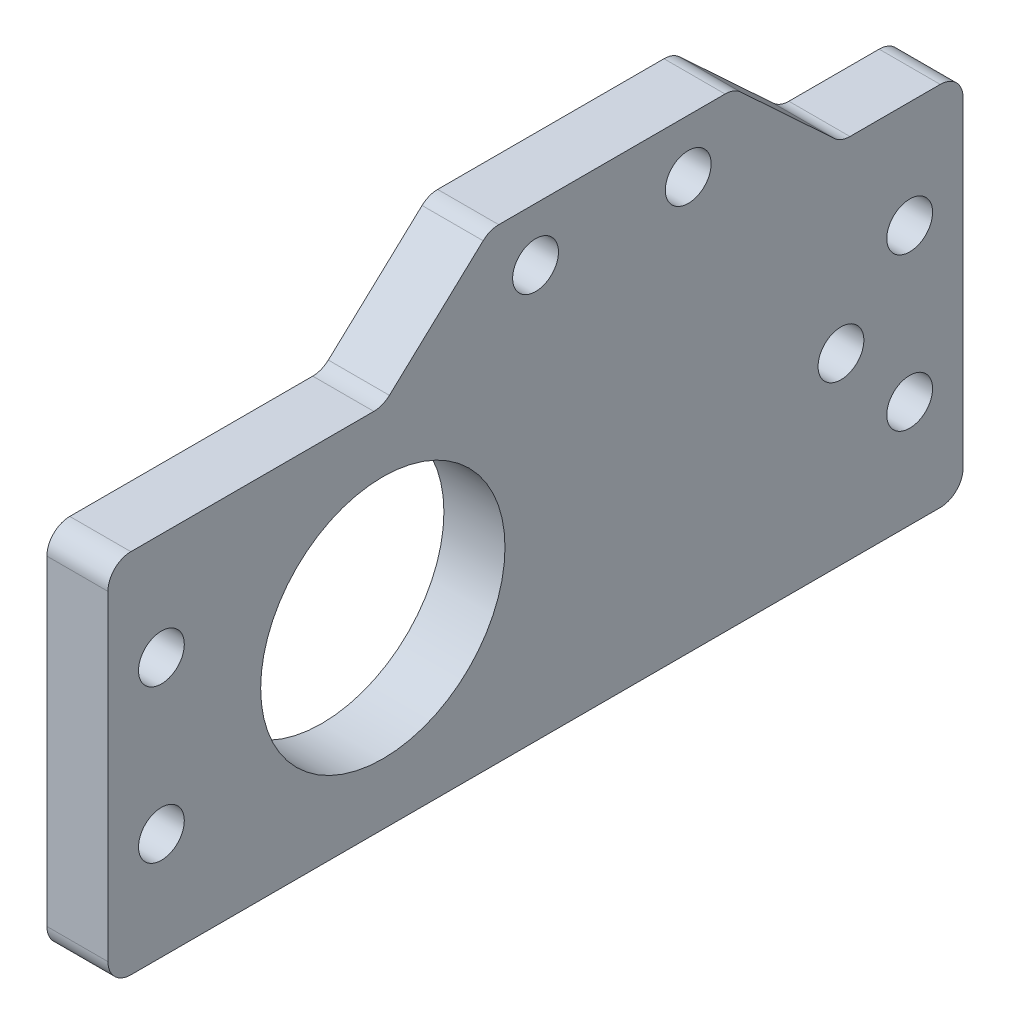
from build123d import *

# Parameters (mm, degrees)
SKETCH_1_R      = 1.5
SKETCH_1_R_2    = 8
EXTRUDE_1_DEPTH = 4


with BuildPart() as part:
    # 草图1 → 凸台-拉伸1 (new body)
    with BuildSketch(Plane(origin=(0, 0, 0), x_dir=(0, 0, -1), z_dir=(1, 0, 0))):
        with BuildLine():
            Line((20.589035366, 12), (26.5, 12))
            ThreePointArc((26.5, 12), (27.560660172, 11.560660172), (28, 10.5))
            Line((28, 10.5), (28, -10.5))
            ThreePointArc((28, -10.5), (27.560660172, -11.560660172), (26.5, -12))
            Line((26.5, -12), (-26.5, -12))
            ThreePointArc((-26.5, -12), (-27.560660172, -11.560660172), (-28, -10.5))
            Line((-28, -10.5), (-28, 10.5))
            ThreePointArc((-28, 10.5), (-27.560660172, 11.560660172), (-26.5, 12))
            Line((-26.5, 12), (-10.589035366, 12))
            ThreePointArc((-10.589035366, 12), (-10.040758683, 12.103793469), (-9.568358717, 12.400809763))
            Line((-9.568358717, 12.400809763), (-3.431641283, 18.099190237))
            ThreePointArc((-3.431641283, 18.099190237), (-2.959241317, 18.396206531), (-2.410964634, 18.5))
            Line((-2.410964634, 18.5), (12.410964634, 18.5))
            ThreePointArc((12.410964634, 18.5), (12.959241317, 18.396206531), (13.431641283, 18.099190237))
            Line((13.431641283, 18.099190237), (19.568358717, 12.400809763))
            ThreePointArc((19.568358717, 12.400809763), (20.040758683, 12.103793469), (20.589035366, 12))
        make_face()
        with Locations((0, 15)):
            Circle(SKETCH_1_R, mode=Mode.SUBTRACT)
        with Locations((20, 0)):
            Circle(SKETCH_1_R, mode=Mode.SUBTRACT)
        with Locations((-10, 0)):
            Circle(SKETCH_1_R_2, mode=Mode.SUBTRACT)
        with Locations((24.5, 5)):
            Circle(SKETCH_1_R, mode=Mode.SUBTRACT)
        with Locations((24.5, -5)):
            Circle(SKETCH_1_R, mode=Mode.SUBTRACT)
        with Locations((-24.5, 5)):
            Circle(SKETCH_1_R, mode=Mode.SUBTRACT)
        with Locations((-24.5, -5)):
            Circle(SKETCH_1_R, mode=Mode.SUBTRACT)
        with Locations((10, 15)):
            Circle(SKETCH_1_R, mode=Mode.SUBTRACT)
    extrude(amount=EXTRUDE_1_DEPTH)


solid = part.part
